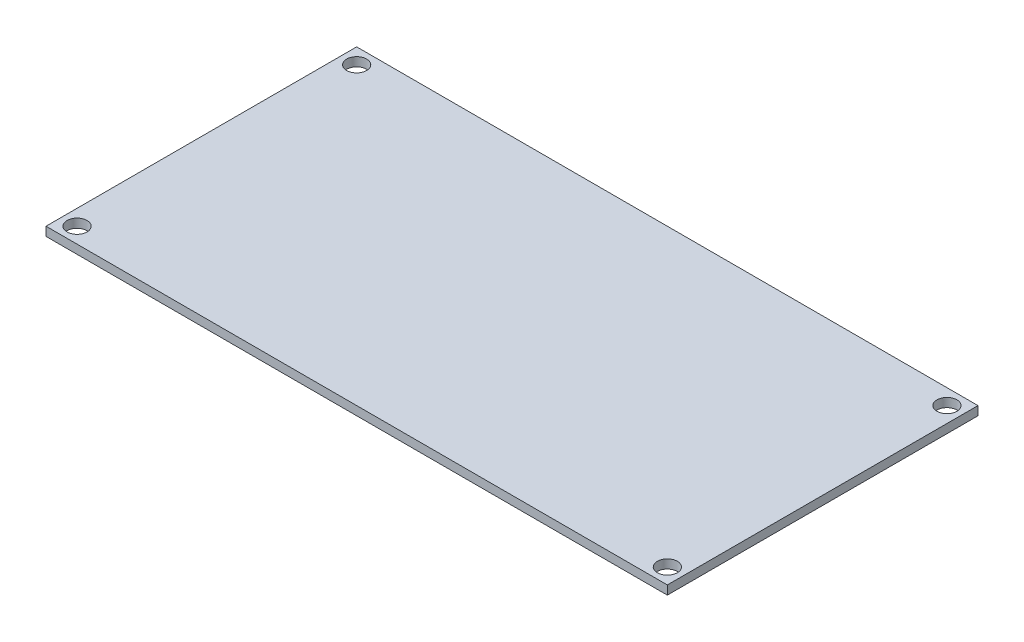
from build123d import *

# Parameters (mm, degrees)
SKETCH1_W           = 101.6
SKETCH1_H           = 50.8
BOSS_EXTRUDE1_DEPTH = 1.4478
SKETCH2_R           = 1.63195
CUT_EXTRUDE1_DEPTH  = 57.814576693


with BuildPart() as part:
    # Sketch1 → Boss-Extrude1 (new body)
    with BuildSketch(Plane(origin=(0, 0, 0), x_dir=(1, 0, 0), z_dir=(0, 1, 0))):
        Rectangle(SKETCH1_W, SKETCH1_H)
    extrude(amount=BOSS_EXTRUDE1_DEPTH)

    # Sketch2 → Cut-Extrude1 (cut, through all)
    with BuildSketch(Plane(origin=(0, 1.4478, 0), x_dir=(1, 0, 0), z_dir=(0, 1, 0))):
        with Locations(Location((-48.26, 22.86, 0), (0, 0, 270))):
            Circle(SKETCH2_R)
        with Locations(Location((-48.26, -22.86, 0), (0, 0, 270))):
            Circle(SKETCH2_R)
        with Locations(Location((48.26, -22.86, 0), (0, 0, 270))):
            Circle(SKETCH2_R)
        with Locations(Location((48.26, 22.86, 0), (0, 0, 270))):
            Circle(SKETCH2_R)
    extrude(amount=-CUT_EXTRUDE1_DEPTH, mode=Mode.SUBTRACT)


solid = part.part
